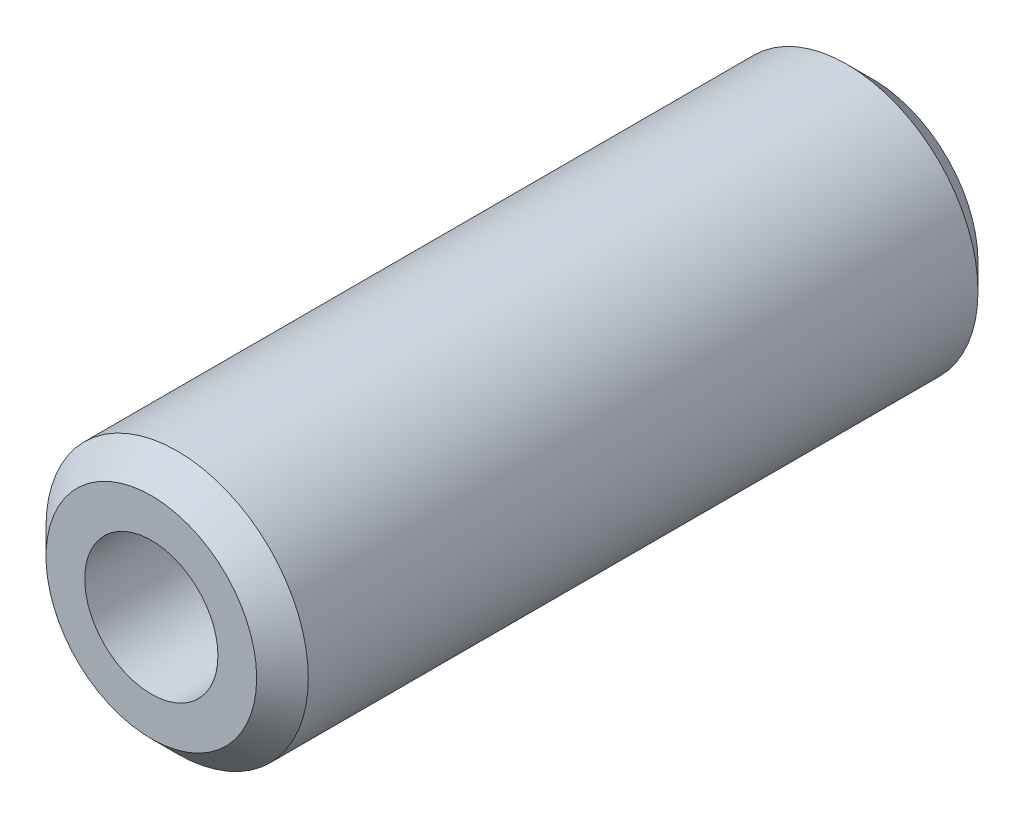
from build123d import *

# Parameters (mm, degrees)
SKETCH2_R           = 12.7
BOSS_EXTRUDE1_DEPTH = 69.85
SKETCH3_R           = 6.45
CUT_EXTRUDE1_DEPTH  = 73.122135992
CHAMFER1_SIZE       = 2.5


with BuildPart() as part:
    # Sketch2 → Boss-Extrude1 (new body)
    with BuildSketch(Plane.XY):
        Circle(SKETCH2_R)
    extrude(amount=BOSS_EXTRUDE1_DEPTH)

    # Sketch3 → Cut-Extrude1 (cut, through all)
    with BuildSketch(Plane.XY.offset(69.85)):
        Circle(SKETCH3_R)
    extrude(amount=-CUT_EXTRUDE1_DEPTH, mode=Mode.SUBTRACT)

    # Chamfer1
    chamfer1_edges = [part.edges().sort_by_distance(p)[0] for p in [
        (-12.7, 0, 0),
        (-12.7, 0, 69.85),
    ]]
    chamfer(chamfer1_edges, length=CHAMFER1_SIZE)


solid = part.part
